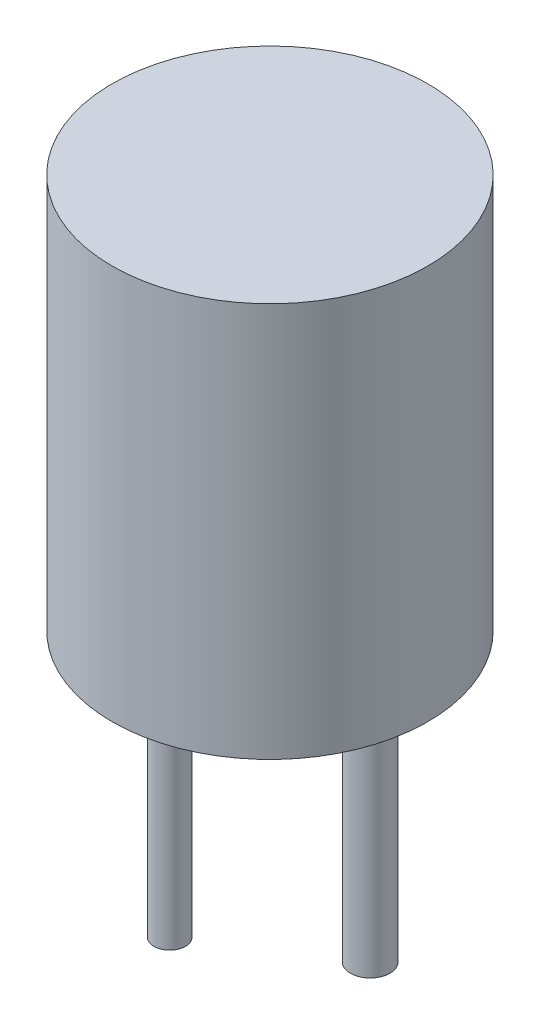
from build123d import *

# Parameters (mm, degrees)
SKETCH_1_R      = 4
EXTRUDE_1_DEPTH = 10
SKETCH_2_R      = 0.4
EXTRUDE_2_DEPTH = 8
SKETCH_3_R      = 0.5
EXTRUDE_3_DEPTH = 6


with BuildPart() as part:
    # 草图1 → 拉伸1 (new body)
    with BuildSketch(Plane(origin=(0, 0, 0), x_dir=(1, 0, 0), z_dir=(0, 1, 0))):
        with Locations(Location((0, 0, 0), (0, 0, 270))):
            Circle(SKETCH_1_R)
    extrude(amount=EXTRUDE_1_DEPTH)

    # 草图2 → 拉伸2 (add)
    with BuildSketch(Plane.XZ):
        with Locations(Location((-2.54, 0, 0), (0, 0, 90))):
            Circle(SKETCH_2_R)
    extrude(amount=EXTRUDE_2_DEPTH)

    # 草图3 → 拉伸3 (add)
    with BuildSketch(Plane.XZ):
        with Locations(Location((2.54, 0, 0), (0, 0, 90))):
            Circle(SKETCH_3_R)
    extrude(amount=EXTRUDE_3_DEPTH)


solid = part.part
